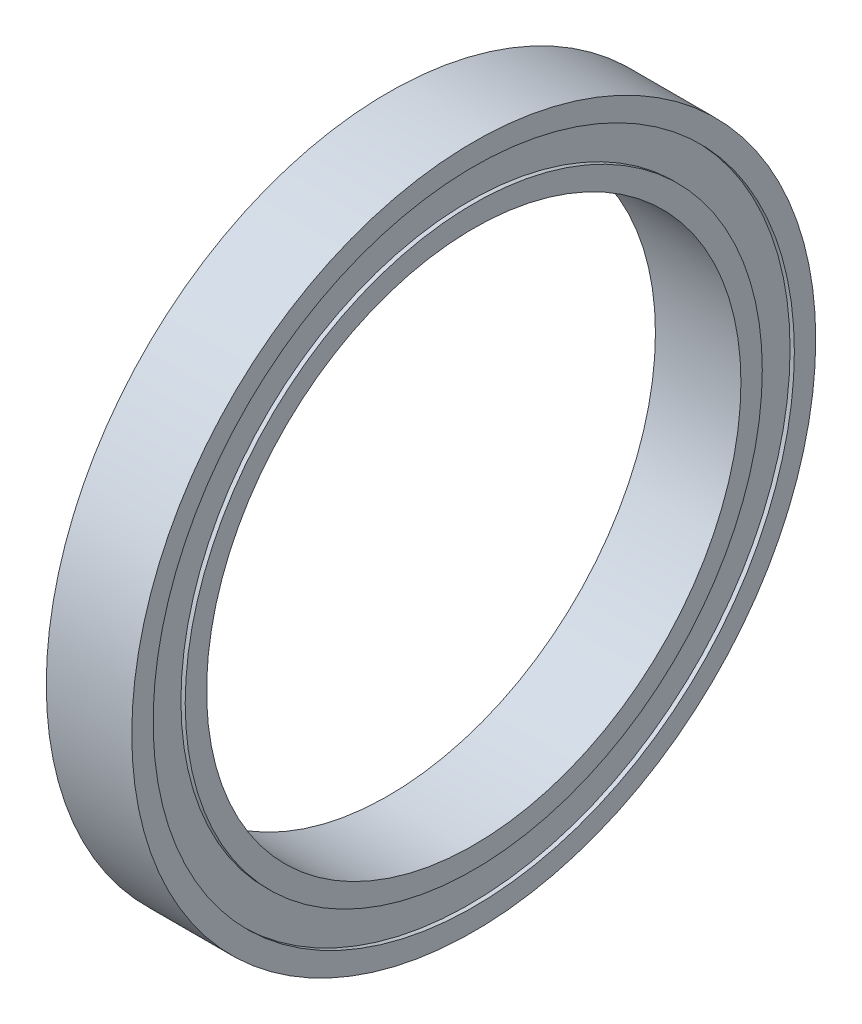
from build123d import *

# Parameters (mm, degrees)
SKETCH_1_R          = 16
SKETCH_1_R_2        = 12.5
EXTRUDE_1_DEPTH     = 4
SKETCH_2_R          = 15
SKETCH_2_R_2        = 13.5
CUT_EXTRUDE_1_DEPTH = 0.2
CUT_EXTRUDE_START   = -3.8
SKETCH_2_2_R        = 15
SKETCH_2_2_R_2      = 13.5
CUT_EXTRUDE_2_DEPTH = 0.2


with BuildPart() as part:
    # 草图1 → 凸台-拉伸1 (new body)
    with BuildSketch(Plane(origin=(0, 0, 0), x_dir=(0, 0, -1), z_dir=(1, 0, 0))):
        Circle(SKETCH_1_R)
        Circle(SKETCH_1_R_2, mode=Mode.SUBTRACT)
    extrude(amount=EXTRUDE_1_DEPTH)

    # 草图2 → 切除-拉伸1 (cut)
    with BuildSketch(Plane(origin=(4, 0, 0), x_dir=(0, 0, -1), z_dir=(1, 0, 0))):
        Circle(SKETCH_2_R)
        Circle(SKETCH_2_R_2, mode=Mode.SUBTRACT)
    extrude(amount=-CUT_EXTRUDE_1_DEPTH, mode=Mode.SUBTRACT)

    # 草图2<2> → 切除-拉伸2 (cut)
    with BuildSketch(Plane(origin=(4, 0, 0), x_dir=(0, 0, -1), z_dir=(1, 0, 0)).offset(CUT_EXTRUDE_START)):
        Circle(SKETCH_2_2_R)
        Circle(SKETCH_2_2_R_2, mode=Mode.SUBTRACT)
    extrude(amount=-CUT_EXTRUDE_2_DEPTH, mode=Mode.SUBTRACT)


solid = part.part
